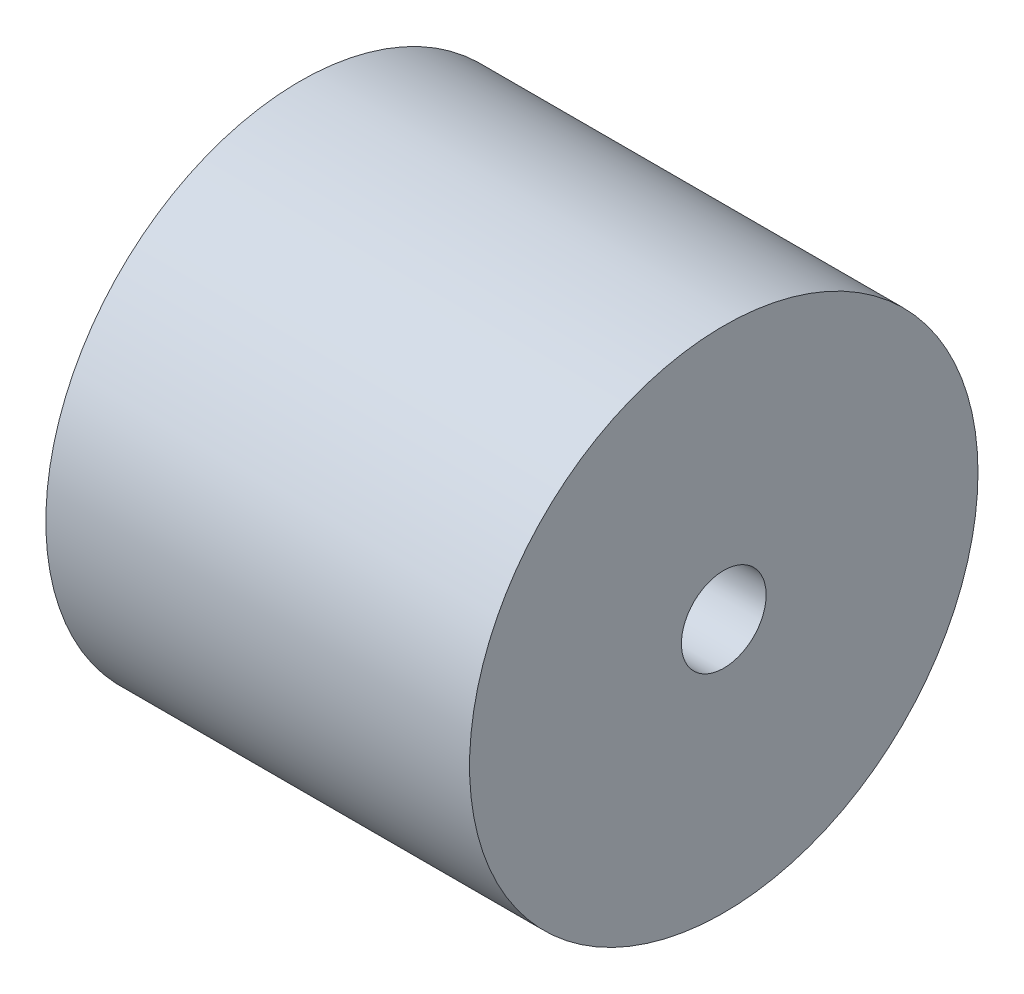
from build123d import *

# Parameters (mm, degrees)
SCHIZZO1_R                   = 18
ESTRUSIONE_ESTRUSIONE1_DEPTH = 30
SCHIZZO2_R                   = 3
TAGLIO_ESTRUSIONE1_DEPTH     = 40.344631146


with BuildPart() as part:
    # Schizzo1 → Estrusione-Estrusione1 (new body)
    with BuildSketch(Plane(origin=(0, 0, 0), x_dir=(0, 0, -1), z_dir=(1, 0, 0))):
        Circle(SCHIZZO1_R)
    extrude(amount=ESTRUSIONE_ESTRUSIONE1_DEPTH)

    # Schizzo2 → Taglio-Estrusione1 (cut, through all)
    with BuildSketch(Plane(origin=(0, 0, 0), x_dir=(0, 0, -1), z_dir=(1, 0, 0))):
        Circle(SCHIZZO2_R)
    extrude(amount=TAGLIO_ESTRUSIONE1_DEPTH, mode=Mode.SUBTRACT)


solid = part.part
